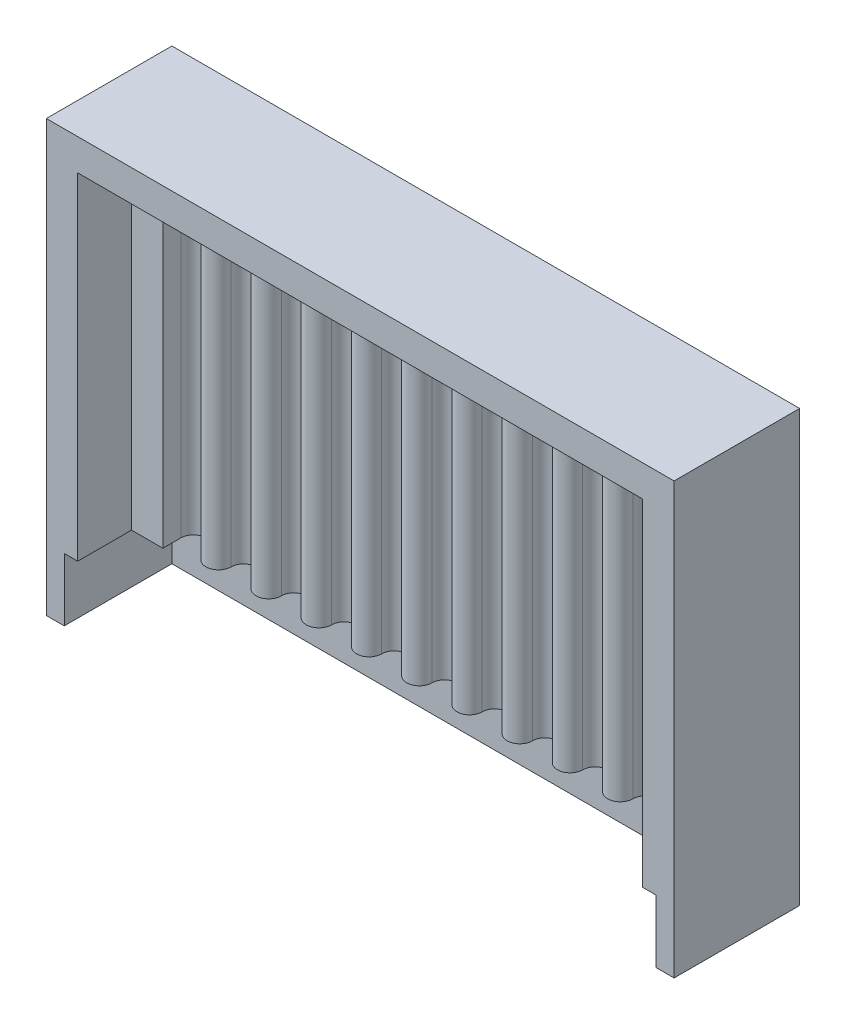
from build123d import *

# Parameters (mm, degrees)
SKETCH_1_W          = 35
SKETCH_1_H          = 24
EXTRUDE_1_DEPTH     = 7
SKETCH_2_W          = 31.5
SKETCH_2_H          = 20.5
CUT_EXTRUDE_1_DEPTH = 3
SKETCH_3_W          = 28
SKETCH_3_H          = 17
CUT_EXTRUDE_2_DEPTH = 2
EXTRUDE_2_DEPTH     = 17
SKETCH_6_W          = 33
SKETCH_6_H          = 6
CUT_EXTRUDE_3_DEPTH = 3.5


with BuildPart() as part:
    # 草图1 → 凸台-拉伸1 (new body)
    with BuildSketch(Plane.XY):
        Rectangle(SKETCH_1_W, SKETCH_1_H)
    extrude(amount=EXTRUDE_1_DEPTH)

    # 草图2 → 切除-拉伸1 (cut)
    with BuildSketch(Plane.XY.offset(7)):
        Rectangle(SKETCH_2_W, SKETCH_2_H)
    extrude(amount=-CUT_EXTRUDE_1_DEPTH, mode=Mode.SUBTRACT)

    # 草图3 → 切除-拉伸2 (cut)
    with BuildSketch(Plane.XY.offset(4)):
        Rectangle(SKETCH_3_W, SKETCH_3_H)
    extrude(amount=-CUT_EXTRUDE_2_DEPTH, mode=Mode.SUBTRACT)

    # 草图4 → 凸台-拉伸2 (add)
    with BuildSketch(Plane.XZ.offset(-8.5)):
        with BuildLine():
            Line((-15, 3), (-15, 1))
            Line((-15, 1), (15, 1))
            Line((15, 1), (15, 3))
            Line((15, 3), (14, 3))
            ThreePointArc((14, 3), (13.3, 3.7), (12.6, 3))
            ThreePointArc((12.6, 3), (11.9, 2.3), (11.2, 3))
            ThreePointArc((11.2, 3), (10.5, 3.7), (9.8, 3))
            ThreePointArc((9.8, 3), (9.1, 2.3), (8.4, 3))
            ThreePointArc((8.4, 3), (7.7, 3.7), (7, 3))
            ThreePointArc((7, 3), (6.3, 2.3), (5.6, 3))
            ThreePointArc((5.6, 3), (4.9, 3.7), (4.2, 3))
            ThreePointArc((4.2, 3), (3.5, 2.3), (2.8, 3))
            ThreePointArc((2.8, 3), (2.1, 3.7), (1.4, 3))
            ThreePointArc((1.4, 3), (0.7, 2.3), (0, 3))
            ThreePointArc((0, 3), (-0.7, 3.7), (-1.4, 3))
            ThreePointArc((-1.4, 3), (-2.1, 2.3), (-2.8, 3))
            ThreePointArc((-2.8, 3), (-3.5, 3.7), (-4.2, 3))
            ThreePointArc((-4.2, 3), (-4.9, 2.3), (-5.6, 3))
            ThreePointArc((-5.6, 3), (-6.3, 3.7), (-7, 3))
            ThreePointArc((-7, 3), (-7.7, 2.3), (-8.4, 3))
            ThreePointArc((-8.4, 3), (-9.1, 3.7), (-9.8, 3))
            ThreePointArc((-9.8, 3), (-10.5, 2.3), (-11.2, 3))
            ThreePointArc((-11.2, 3), (-11.9, 3.7), (-12.6, 3))
            ThreePointArc((-12.6, 3), (-13.3, 2.3), (-14, 3))
            Line((-14, 3), (-15, 3))
        make_face()
    extrude(amount=EXTRUDE_2_DEPTH)

    # 草图6 → 切除-拉伸3 (cut)
    with BuildSketch(Plane.XZ.offset(12)):
        with Locations((0, 4)):
            Rectangle(SKETCH_6_W, SKETCH_6_H)
    extrude(amount=-CUT_EXTRUDE_3_DEPTH, mode=Mode.SUBTRACT)


solid = part.part
